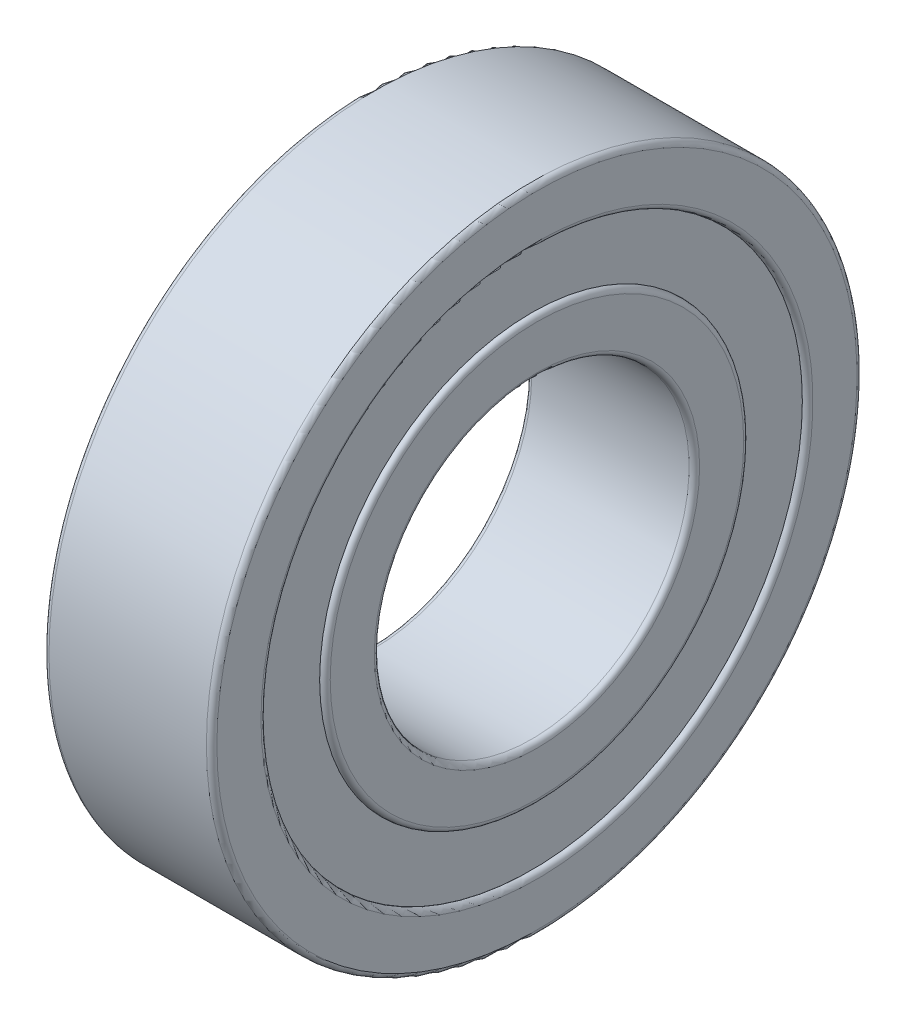
from build123d import *

# Parameters (mm, degrees)
SKIZZE1_R     = 6
VERRUNDUNG1_R = 0.5
SKIZZE4_W     = 0.5
SKIZZE4_H     = 5.58


with BuildPart() as part:
    # Skizze1 → Basis-Rotation (revolve)
    with BuildSketch(Plane.XY, mode=Mode.PRIVATE) as basis_rotation_sk:
        with BuildLine():
            Line((8, 15), (-8, 15))
            Line((-8, 15), (-8, 20.2))
            Line((-8, 20.2), (-5.317903722, 20.2))
            ThreePointArc((-5.317903722, 20.2), (-6.01, 23), (-5.317903722, 25.8))
            Line((-5.317903722, 25.8), (-8, 25.8))
            Line((-8, 25.8), (-8, 31))
            Line((-8, 31), (8, 31))
            Line((8, 31), (8, 25.8))
            Line((8, 25.8), (5.317903722, 25.8))
            ThreePointArc((5.317903722, 25.8), (6.01, 23), (5.317903722, 20.2))
            Line((5.317903722, 20.2), (8, 20.2))
            Line((8, 20.2), (8, 15))
        make_face()
        with Locations((0, 23)):
            Circle(SKIZZE1_R, mode=Mode.SUBTRACT)
    revolve(basis_rotation_sk.sketch.rotate(Axis((-18.681116423, 0, 0), (1, 0, 0)), 90), axis=Axis((-18.681116423, 0, 0), (1, 0, 0)))

    # Verrundung1
    verrundung1_edges = [part.edges().sort_by_distance(p)[0] for p in [
        (-8, 0, -20.2),
        (-8, 0, -25.8),
        (-8, 0, -31),
        (8, 0, -31),
        (8, 0, -25.8),
        (8, 0, -20.2),
        (8, 0, -15),
        (-8, 0, -15),
    ]]
    fillet(verrundung1_edges, radius=VERRUNDUNG1_R)


with BuildPart() as body_2:
    # Skizze4 → Rotation1 (revolve)
    with BuildSketch(Plane.XY, mode=Mode.PRIVATE) as rotation1_sk:
        with Locations((-7.25, 23)):
            Rectangle(SKIZZE4_W, SKIZZE4_H)
        with Locations((7.25, 23)):
            Rectangle(SKIZZE4_W, SKIZZE4_H)
    revolve(rotation1_sk.sketch.rotate(Axis((0, 0, 0), (-1, 0, 0)), 90), axis=Axis((0, 0, 0), (-1, 0, 0)))


solid = Compound([part.part, body_2.part])
